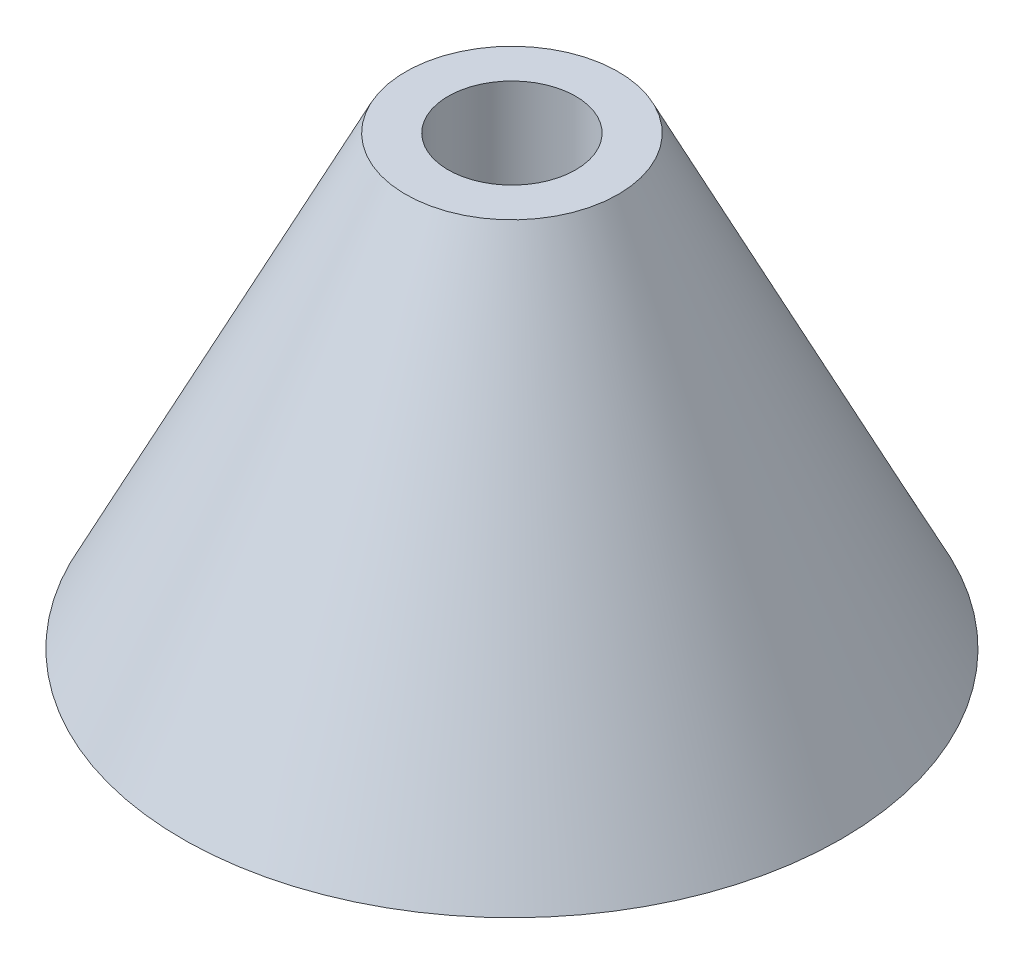
from build123d import *


with BuildPart() as part:
    # Sketch1 → Revolve1 (revolve)
    with BuildSketch(Plane.XY):
        Polygon((6, -5.222222222), (6, 36.777777778), (10, 36.777777778), (31, -5.222222222), align=None)
    revolve(axis=Axis((0, 0, 0), (0, 1, 0)))


solid = part.part
